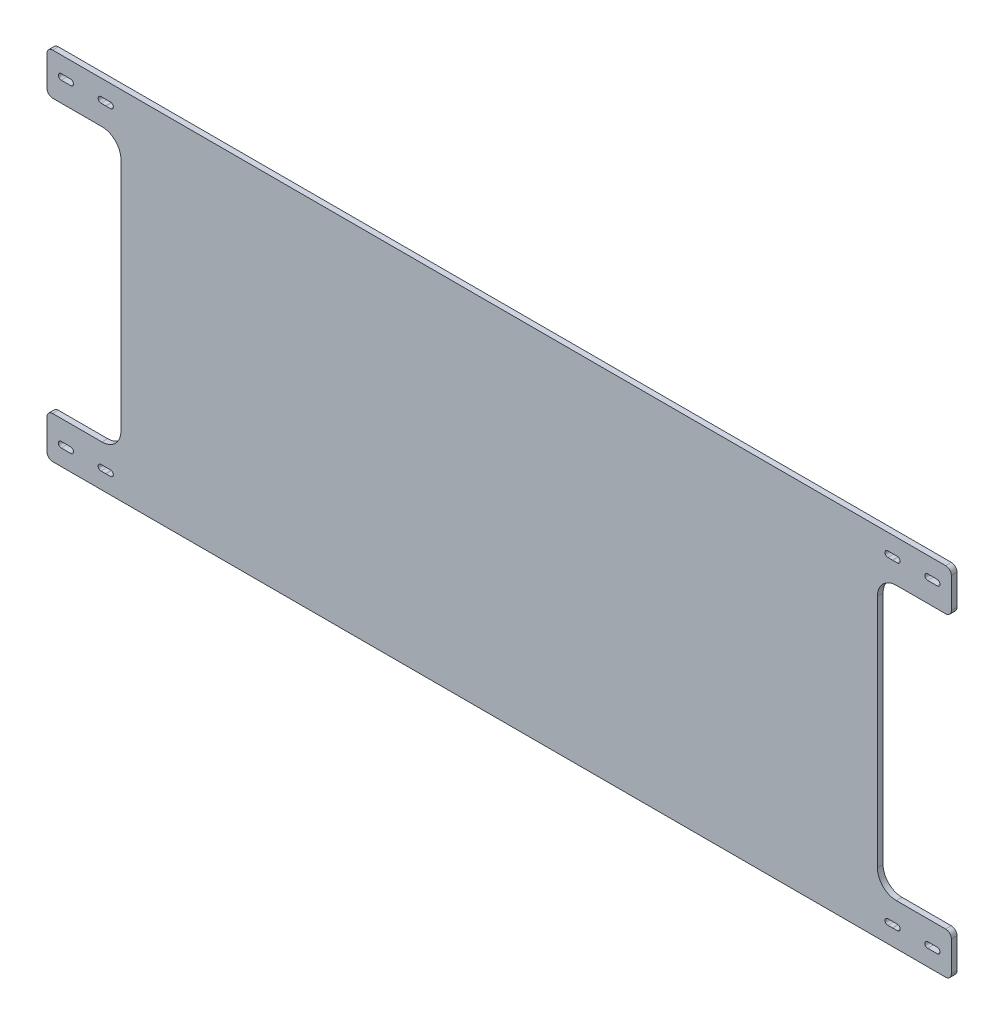
from build123d import *

# Parameters (mm, degrees)
SKETCH_1_W          = 477
SKETCH_1_H          = 188
EXTRUDE_1_DEPTH     = 3
SKETCH_2_R          = 1.5
SKETCH_2_R_2        = 1.502344372
CUT_EXTRUDE_1_DEPTH = 257.373263037
CUT_EXTRUDE_3_DEPTH = 10
SKETCH_3_W          = 39
SKETCH_3_H          = 144
CUT_EXTRUDE_4_DEPTH = 10
FILLET_1_R          = 10
FILLET_2_R          = 3


with BuildPart() as part:
    # 草图1 → 凸台-拉伸1 (new body)
    with BuildSketch(Plane.XY):
        Rectangle(SKETCH_1_W, SKETCH_1_H)
    extrude(amount=EXTRUDE_1_DEPTH)

    # 草图2 → 切除-拉伸1 (cut, through all)
    with BuildSketch(Plane.XY.offset(3)):
        with Locations((228.5, 84)):
            Circle(SKETCH_2_R)
        with Locations((-228.5, 84)):
            Circle(SKETCH_2_R)
        with Locations((-228.5, -84)):
            Circle(SKETCH_2_R)
        with Locations((228.5, -84)):
            Circle(SKETCH_2_R)
        with Locations((207.5, -84)):
            Circle(SKETCH_2_R_2)
        with Locations(Location((207.5, 84, 0), (0, 0, 180))):
            Circle(SKETCH_2_R_2)
        with Locations(Location((-207.5, -84, 0), (0, 0, 180))):
            Circle(SKETCH_2_R_2)
        with Locations((-207.5, 84)):
            Circle(SKETCH_2_R_2)
    extrude(amount=-CUT_EXTRUDE_1_DEPTH, mode=Mode.SUBTRACT)

    # 草图4 → 切除-拉伸3 (cut)
    with BuildSketch(Plane.XY.offset(3)):
        with BuildLine():
            Line((-231, 85.5), (-226, 85.5))
            ThreePointArc((-226, 85.5), (-224.5, 84), (-226, 82.5))
            Line((-226, 82.5), (-231, 82.5))
            ThreePointArc((-231, 82.5), (-232.5, 84), (-231, 85.5))
        make_face()
        with BuildLine():
            Line((-210, 85.5), (-205, 85.5))
            ThreePointArc((-205, 85.5), (-203.5, 84), (-205, 82.5))
            Line((-205, 82.5), (-210, 82.5))
            ThreePointArc((-210, 82.5), (-211.5, 84), (-210, 85.5))
        make_face()
        with BuildLine():
            Line((231, 85.5), (226, 85.5))
            ThreePointArc((226, 85.5), (224.5, 84), (226, 82.5))
            Line((226, 82.5), (231, 82.5))
            ThreePointArc((231, 82.5), (232.5, 84), (231, 85.5))
        make_face()
        with BuildLine():
            Line((210, 85.5), (205, 85.5))
            ThreePointArc((205, 85.5), (203.5, 84), (205, 82.5))
            Line((205, 82.5), (210, 82.5))
            ThreePointArc((210, 82.5), (211.5, 84), (210, 85.5))
        make_face()
    cut_extrude_3 = extrude(amount=-CUT_EXTRUDE_3_DEPTH, mode=Mode.SUBTRACT)

    # 镜向1: 切除-拉伸3 across plane
    add(cut_extrude_3.mirror(Plane.ZX), mode=Mode.SUBTRACT)

    # 草图3 → 切除-拉伸4 (cut)
    with BuildSketch(Plane.XY.offset(3)):
        with Locations((219, 0)):
            Rectangle(SKETCH_3_W, SKETCH_3_H)
        with Locations((-219, 0)):
            Rectangle(SKETCH_3_W, SKETCH_3_H)
    extrude(amount=-CUT_EXTRUDE_4_DEPTH, mode=Mode.SUBTRACT)

    # 圆角1
    fillet_1_edges = [part.edges().sort_by_distance(p)[0] for p in [
        (199.5, -72, 1.5),
        (199.5, 72, 1.5),
        (-199.5, 72, 1.5),
        (-199.5, -72, 1.5),
    ]]
    fillet(fillet_1_edges, radius=FILLET_1_R)

    # 圆角2
    fillet_2_edges = [part.edges().sort_by_distance(p)[0] for p in [
        (-238.5, 72, 1.5),
        (-238.5, -72, 1.5),
        (238.5, 72, 1.5),
        (238.5, -72, 1.5),
        (238.5, -94, 1.5),
        (-238.5, -94, 1.5),
        (-238.5, 94, 1.5),
        (238.5, 94, 1.5),
    ]]
    fillet(fillet_2_edges, radius=FILLET_2_R)


solid = part.part
